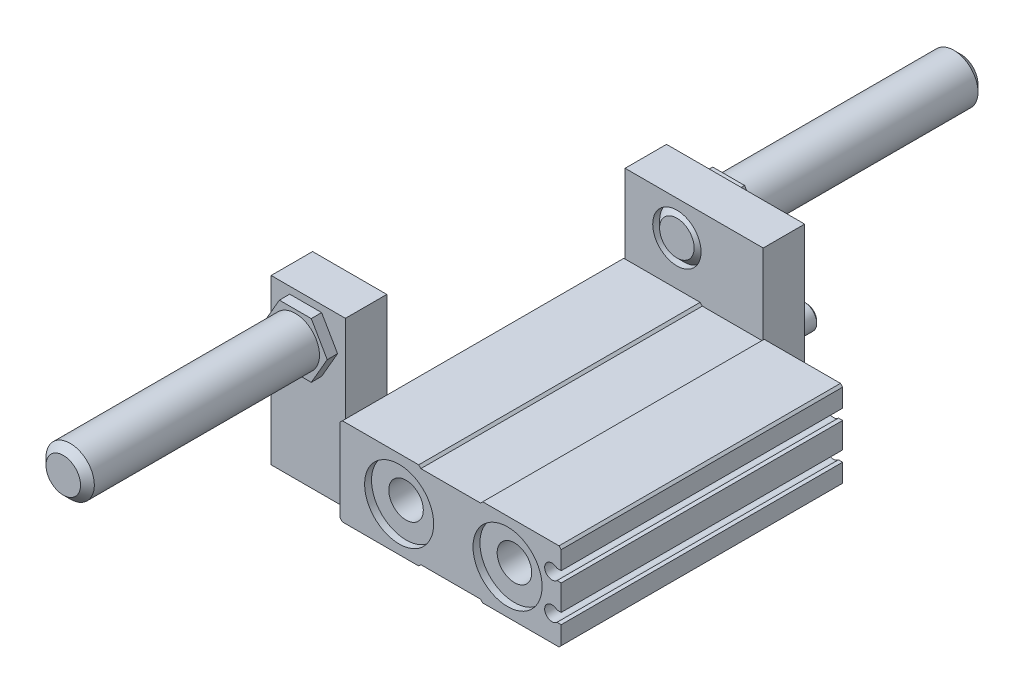
from build123d import *

# Parameters (mm, degrees)
BASE_EXTRUDE_START                = -81.5
BASE_EXTRUDE_DEPTH                = 81.5
SKETCH2_R                         = 10
CUT_EXTRUDE1_DEPTH                = 80.2
SKETCH4_R                         = 10
BOSS_EXTRUDE1_DEPTH               = 10
CUT_EXTRUDE3_REACH                = 88.633
SKETCH19_R                        = 5
F_1_4_20_TAPPED_HOLE1_D           = 5.1054
F_1_4_20_TAPPED_HOLE1_DEPTH       = 18.288
F_1_4_20_TAPPED_HOLE1_CBORE_D     = 6.35
F_1_4_20_TAPPED_HOLE1_CBORE_DEPTH = 11.938
F_1_4_20_TAPPED_HOLE1_TIP         = 1.533816902
F_10_32_TAPPED_HOLE2_D            = 4.0386
F_10_32_TAPPED_HOLE2_DEPTH        = 13.8684
F_10_32_TAPPED_HOLE2_CBORE_D      = 4.826
F_10_32_TAPPED_HOLE2_CBORE_DEPTH  = 9.906
F_10_32_TAPPED_HOLE2_TIP          = 1.213317848
HOLE1_D                           = 5
HOLE1_DEPTH                       = 5
CUT_EXTRUDE4_DEPTH                = 5
F_10_32_TAPPED_HOLE1_D            = 4.0386
F_10_32_TAPPED_HOLE1_DEPTH        = 13.6144
F_10_32_TAPPED_HOLE1_CBORE_D      = 4.826
F_10_32_TAPPED_HOLE1_CBORE_DEPTH  = 9.652
F_10_32_TAPPED_HOLE1_TIP          = 1.213317848
SKETCH30_W                        = 40
SKETCH30_H                        = 47
BOSS_EXTRUDE2_DEPTH               = 12
BOSS_EXTRUDE3_DEPTH               = 3
SKETCH35_R                        = 3.5
BOSS_EXTRUDE5_DEPTH               = 5
CHAMFER2_SIZE                     = 0.5
BOSS_EXTRUDE6_DEPTH               = 12
BOSS_EXTRUDE7_DEPTH               = 3
CUT_EXTRUDE7_REACH                = 121.044
SKETCH38_R                        = 7
CUT_EXTRUDE8_REACH                = 179.193
SKETCH46_R                        = 7
CHAMFER3_SIZE                     = 2


with BuildPart() as part:
    # Sketch1 → Base-Extrude (new body)
    with BuildSketch(Plane(origin=(0, 0, 48.65), x_dir=(-1, 0, 0), z_dir=(0, 0, 1)).offset(BASE_EXTRUDE_START)):
        with BuildLine():
            Line((31.365, 12.6873), (32, 12.0523))
            Line((32, 12.0523), (32, -12.0523))
            Line((32, -12.0523), (31.365, -12.6873))
            Line((31.365, -12.6873), (9.271, -12.6873))
            Line((9.271, -12.6873), (8.636, -12.0523))
            Line((8.636, -12.0523), (-8.636, -12.0523))
            Line((-8.636, -12.0523), (-9.271, -12.6873))
            Line((-9.271, -12.6873), (-31.365, -12.6873))
            Line((-31.365, -12.6873), (-32, -12.0523))
            Line((-32, -12.0523), (-32, -6.7691))
            Line((-32, -6.7691), (-30.791853982, -6.7691))
            ThreePointArc((-30.791853982, -6.7691), (-27.209184534, -5.2324), (-30.791853982, -3.6957))
            Line((-30.791853982, -3.6957), (-32, -3.6957))
            Line((-32, -3.6957), (-32, 3.6957))
            Line((-32, 3.6957), (-30.791853982, 3.6957))
            ThreePointArc((-30.791853982, 3.6957), (-27.209184534, 5.2324), (-30.791853982, 6.7691))
            Line((-30.791853982, 6.7691), (-32, 6.7691))
            Line((-32, 6.7691), (-32, 12.0523))
            Line((-32, 12.0523), (-31.365, 12.6873))
            Line((-31.365, 12.6873), (-9.271, 12.6873))
            Line((-9.271, 12.6873), (-8.636, 12.0523))
            Line((-8.636, 12.0523), (8.636, 12.0523))
            Line((8.636, 12.0523), (9.271, 12.6873))
            Line((9.271, 12.6873), (31.365, 12.6873))
        make_face()
    extrude(amount=BASE_EXTRUDE_DEPTH)

    # Sketch2 → Cut-Extrude1 (cut)
    with BuildSketch(Plane(origin=(0, 0, 48.65), x_dir=(-1, 0, 0), z_dir=(0, 0, -1))):
        with Locations(Location((-16.4592, 0, 0), (0, 0, 180))):
            Circle(SKETCH2_R)
        with Locations(Location((14.9352, 0, 0), (0, 0, 180))):
            Circle(SKETCH2_R)
    extrude(amount=CUT_EXTRUDE1_DEPTH, mode=Mode.SUBTRACT)

    # Sketch4 → Boss-Extrude1 (add)
    with BuildSketch(Plane.XY.offset(46.65)):
        with Locations((16.4592, 0)):
            Circle(SKETCH4_R)
        with Locations((-14.9352, 0)):
            Circle(SKETCH4_R)
    extrude(amount=-BOSS_EXTRUDE1_DEPTH)

    # Sketch19 → Cut-Extrude3 (cut, up to next)
    with BuildSketch(Plane.XY.offset(46.65), mode=Mode.PRIVATE) as cut_extrude3_sk1:
        with Locations((16.4592, 0)):
            Circle(SKETCH19_R)
    cut_extrude3_tool1 = extrude(cut_extrude3_sk1.sketch, amount=-CUT_EXTRUDE3_REACH, mode=Mode.PRIVATE) & part.part
    # Sketch19 → Cut-Extrude3 (cut, up to next)
    with BuildSketch(Plane.XY.offset(46.65), mode=Mode.PRIVATE) as cut_extrude3_sk2:
        with Locations((-14.9352, 0)):
            Circle(SKETCH19_R)
    cut_extrude3_tool2 = extrude(cut_extrude3_sk2.sketch, amount=-CUT_EXTRUDE3_REACH, mode=Mode.PRIVATE) & part.part
    add(cut_extrude3_tool1.solids().sort_by_distance((16.4592, 0, 46.65))[0], mode=Mode.SUBTRACT)
    add(cut_extrude3_tool2.solids().sort_by_distance((-14.9352, 0, 46.65))[0], mode=Mode.SUBTRACT)

    # 1/4-20 Tapped Hole1
    with Locations(Plane.XZ.offset(12.0523)):
        with Locations((0, 23.15), (0, -6.85)):
            CounterBoreHole(F_1_4_20_TAPPED_HOLE1_D / 2, F_1_4_20_TAPPED_HOLE1_CBORE_D / 2, F_1_4_20_TAPPED_HOLE1_CBORE_DEPTH, depth=F_1_4_20_TAPPED_HOLE1_DEPTH)
            with Locations((0, 0, -(F_1_4_20_TAPPED_HOLE1_DEPTH + F_1_4_20_TAPPED_HOLE1_TIP / 2))):  # 118° drill point
                Cone(0, F_1_4_20_TAPPED_HOLE1_D / 2, F_1_4_20_TAPPED_HOLE1_TIP, mode=Mode.SUBTRACT)

    # #10-32 Tapped Hole2
    with Locations(Plane(origin=(0, 0, -32.85), x_dir=(-1, 0, 0), z_dir=(0, 0, -1))):
        with Locations((28, -7.5873), (28, 7.8127), (-4.5, -7.5873), (-4.5, 7.8127)):
            CounterBoreHole(F_10_32_TAPPED_HOLE2_D / 2, F_10_32_TAPPED_HOLE2_CBORE_D / 2, F_10_32_TAPPED_HOLE2_CBORE_DEPTH, depth=F_10_32_TAPPED_HOLE2_DEPTH)
            with Locations((0, 0, -(F_10_32_TAPPED_HOLE2_DEPTH + F_10_32_TAPPED_HOLE2_TIP / 2))):  # 118° drill point
                Cone(0, F_10_32_TAPPED_HOLE2_D / 2, F_10_32_TAPPED_HOLE2_TIP, mode=Mode.SUBTRACT)

    # Hole1
    with Locations(Plane.XZ.offset(12.6873)):
        with Locations((-27.5, 36.15)):
            Hole(HOLE1_D / 2, depth=HOLE1_DEPTH)

    # Sketch27 → Cut-Extrude4 (cut)
    with BuildSketch(Plane.XZ.offset(12.6873)):
        with BuildLine():
            Line((-30, -13.35), (-30, -14.35))
            ThreePointArc((-30, -14.35), (-27.5, -16.85), (-25, -14.35))
            Line((-25, -14.35), (-25, -13.35))
            ThreePointArc((-25, -13.35), (-27.5, -10.85), (-30, -13.35))
        make_face()
    extrude(amount=-CUT_EXTRUDE4_DEPTH, mode=Mode.SUBTRACT)

    # #10-32 Tapped Hole1
    with Locations(Plane.ZY.offset(32)):
        with Locations((27.85, -0.1873), (-24.85, -0.1873)):
            CounterBoreHole(F_10_32_TAPPED_HOLE1_D / 2, F_10_32_TAPPED_HOLE1_CBORE_D / 2, F_10_32_TAPPED_HOLE1_CBORE_DEPTH, depth=F_10_32_TAPPED_HOLE1_DEPTH)
            with Locations((0, 0, -(F_10_32_TAPPED_HOLE1_DEPTH + F_10_32_TAPPED_HOLE1_TIP / 2))):  # 118° drill point
                Cone(0, F_10_32_TAPPED_HOLE1_D / 2, F_10_32_TAPPED_HOLE1_TIP, mode=Mode.SUBTRACT)

    # Sketch30 → Boss-Extrude2 (add)
    with BuildSketch(Plane(origin=(0, 0, -32.85), x_dir=(-1, 0, 0), z_dir=(0, 0, -1))):
        with Locations((11, 11.9477)):
            Rectangle(SKETCH30_W, SKETCH30_H)
    extrude(amount=BOSS_EXTRUDE2_DEPTH)

    # Sketch31 → Boss-Extrude3 (add)
    with BuildSketch(Plane(origin=(0, 0, -44.85), x_dir=(-1, 0, 0), z_dir=(0, 0, -1))):
        Polygon((25.237604307, 25.4477), (20.618802154, 33.4477), (11.381197846, 33.4477), (6.762395693, 25.4477), (11.381197846, 17.4477), (20.618802154, 17.4477), align=None)
    extrude(amount=BOSS_EXTRUDE3_DEPTH)

    # Sketch35 → Boss-Extrude5 (add)
    with BuildSketch(Plane(origin=(0, 0, -44.85), x_dir=(-1, 0, 0), z_dir=(0, 0, -1))):
        with Locations(Location((28, 7.8127, 0), (0, 0, 328.997280866))):
            Circle(SKETCH35_R)
        with Locations((-4.5, 7.8127)):
            Circle(SKETCH35_R)
        with Locations((-4.5, -7.5873)):
            Circle(SKETCH35_R)
        with Locations(Location((28, -7.5873, 0), (0, 0, 328.997280866))):
            Circle(SKETCH35_R)
    extrude(amount=BOSS_EXTRUDE5_DEPTH)

    # Chamfer2
    chamfer2_edges = [part.edges().sort_by_distance(p)[0] for p in [
        (-25, 9.615475638, -49.85),
        (8, 7.8127, -49.85),
        (8, -7.5873, -49.85),
        (-25, -5.784524362, -49.85),
    ]]
    chamfer(chamfer2_edges, length=CHAMFER2_SIZE)

    # Sketch36 → Boss-Extrude6 (add)
    with BuildSketch(Plane.XY.offset(34.65)):
        Polygon((-32.5, 36.8127), (-32.5, 10.6873), (-32, 10.6873), (-32, -10.6873), (-54, -10.6873), (-54, 36.8127), align=None)
    extrude(amount=BOSS_EXTRUDE6_DEPTH)

    # Sketch37 → Boss-Extrude7 (add)
    with BuildSketch(Plane.XY.offset(46.65)):
        Polygon((-39.381197846, 34.8127), (-48.618802154, 34.8127), (-53.237604307, 26.8127), (-48.618802154, 18.8127), (-39.381197846, 18.8127), (-34.762395693, 26.8127), align=None)
    extrude(amount=BOSS_EXTRUDE7_DEPTH)

    # Sketch38 → Cut-Extrude7 (cut, up to next)
    with BuildSketch(Plane.XY.offset(49.65), mode=Mode.PRIVATE) as cut_extrude7_sk1:
        with Locations((-44, 26.8127)):
            Circle(SKETCH38_R)
    cut_extrude7_tool1 = extrude(cut_extrude7_sk1.sketch, amount=-CUT_EXTRUDE7_REACH, mode=Mode.PRIVATE) & part.part
    add(cut_extrude7_tool1.solids().sort_by_distance((-44, 26.8127, 49.65))[0], mode=Mode.SUBTRACT)

    # Sketch44 → Boss-Revolve1 (revolve)
    with BuildSketch(Plane(origin=(0, 26.8127, 0), x_dir=(-1, 0, 0), z_dir=(0, 1, 0)), mode=Mode.PRIVATE) as boss_revolve1_sk:
        Polygon((44, 116.85), (51, 116.85), (51, 36.65), (49, 34.65), (44, 34.65), align=None)
    revolve(boss_revolve1_sk.sketch.rotate(Axis((-44, 26.8127, 49.65), (0, 0, -1)), 180), axis=Axis((-44, 26.8127, 49.65), (0, 0, -1)))

    # Sketch46 → Cut-Extrude8 (cut, up to next)
    with BuildSketch(Plane(origin=(0, 0, -47.85), x_dir=(-1, 0, 0), z_dir=(0, 0, -1)), mode=Mode.PRIVATE) as cut_extrude8_sk1:
        with Locations((16, 25.4477)):
            Circle(SKETCH46_R)
    cut_extrude8_tool1 = extrude(cut_extrude8_sk1.sketch, amount=-CUT_EXTRUDE8_REACH, mode=Mode.PRIVATE) & part.part
    add(cut_extrude8_tool1.solids().sort_by_distance((-16, 25.4477, -47.85))[0], mode=Mode.SUBTRACT)

    # Sketch47 → Boss-Revolve2 (revolve)
    with BuildSketch(Plane(origin=(0, 25.4477, 0), x_dir=(-1, 0, 0), z_dir=(0, 1, 0))):
        Polygon((21, -32.85), (16, -32.85), (16, -115.05), (23, -115.05), (23, -34.85), align=None)
    revolve(axis=Axis((-16, 25.4477, -32.85), (0, 0, -1)))

    # Chamfer3
    chamfer3_edges = [part.edges().sort_by_distance(p)[0] for p in [
        (-51, 26.8127, 116.85),
        (-9, 25.4477, -115.05),
    ]]
    chamfer(chamfer3_edges, length=CHAMFER3_SIZE)


solid = part.part
